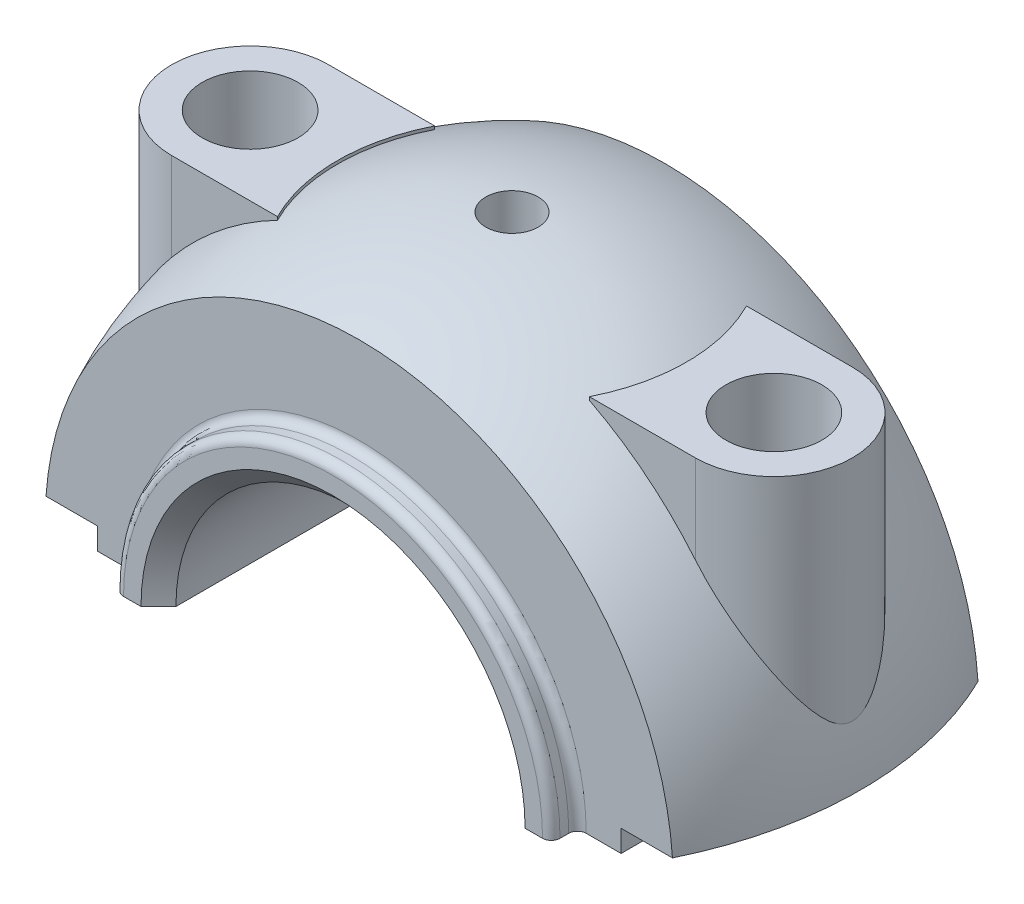
from build123d import *

# Parameters (mm, degrees)
REVOLVE1_ANGLE           = 180
BOSS_EXTRUDE1_REACH      = 58.967
BOSS_EXTRUDE1_END_RADIUS = 40
SKETCH3_R                = 5.5
CUT_EXTRUDE1_DEPTH       = 61.16851336
SKETCH4_R                = 3
CUT_EXTRUDE2_DEPTH       = 61.16851336
CUT_EXTRUDE3_DEPTH       = 61.093676973
CUT_EXTRUDE3_DEPTH_BACK  = 61.093676973
SKETCH5_W                = 18.19644254
SKETCH5_H                = 2.5
SKETCH5_W_2              = 19.029010645
CHAMFER1_SIZE            = 2
FILLET1_R                = 1


with BuildPart() as part:
    # Sketch1 → Revolve1 (revolve)
    with BuildSketch(Plane(origin=(0, 0, 0), x_dir=(1, 0, 0), z_dir=(0, 1, 0))):
        with BuildLine():
            Line((-20, 20.5), (-20, -20.5))
            Line((-20, -20.5), (-25, -20.5))
            Line((-25, -20.5), (-25, -17.5))
            Line((-25, -17.5), (-35.968736425, -17.5))
            ThreePointArc((-35.968736425, -17.5), (-40, 0), (-35.968736425, 17.5))
            Line((-35.968736425, 17.5), (-25, 17.5))
            Line((-25, 17.5), (-25, 20.5))
            Line((-25, 20.5), (-20, 20.5))
        make_face()
    revolve(axis=Axis((0, 0, 0), (0, 0, -1)), revolution_arc=REVOLVE1_ANGLE)

    # Boss-Extrude1: up to this sphere (the profile starts outside it)
    boss_extrude1_end = Location((0, 0, 0)) * Sphere(BOSS_EXTRUDE1_END_RADIUS, mode=Mode.PRIVATE)
    # Sketch2 → Boss-Extrude1 (add, up to the surface)
    with BuildSketch(Plane(origin=(0, 35, 0), x_dir=(-1, 0, 0), z_dir=(0, -1, 0)), mode=Mode.PRIVATE) as boss_extrude1_sk1:
        with BuildLine():
            Line((30, 9), (17.860571099, 9))
            ThreePointArc((17.860571099, 9), (20, 0), (17.860571099, -9))
            Line((17.860571099, -9), (30, -9))
            ThreePointArc((30, -9), (39, 0), (30, 9))
        make_face()
    boss_extrude1_tool1 = extrude(boss_extrude1_sk1.sketch, amount=BOSS_EXTRUDE1_REACH, mode=Mode.PRIVATE) - boss_extrude1_end
    boss_extrude1 = boss_extrude1_tool1.solids().sort_by_distance((-28.288022, 35, 0))[0]
    add(boss_extrude1)

    # Sketch3 → Cut-Extrude1 (cut, through all)
    with BuildSketch(Plane.XZ):
        with Locations(Location((-30, 0, 0), (0, 0, 270))):
            Circle(SKETCH3_R)
    cut_extrude1 = extrude(amount=-CUT_EXTRUDE1_DEPTH, mode=Mode.SUBTRACT)

    # Mirror1: Boss-Extrude1, Cut-Extrude1 across plane
    add(boss_extrude1.mirror(Plane(origin=(0, 0, 0), x_dir=(0, 0, 1), z_dir=(1, 0, 0))))
    add(cut_extrude1.mirror(Plane(origin=(0, 0, 0), x_dir=(0, 0, 1), z_dir=(1, 0, 0))), mode=Mode.SUBTRACT)

    # Sketch4 → Cut-Extrude2 (cut, through all)
    with BuildSketch(Plane.XZ):
        with Locations(Location((0, 0, 0), (0, 0, 270))):
            Circle(SKETCH4_R)
    extrude(amount=-CUT_EXTRUDE2_DEPTH, mode=Mode.SUBTRACT)

    # Sketch5 → Cut-Extrude3 (cut, two sides: drawn at the far end of the back side and taken through both)
    with BuildSketch(Plane.XY.offset(-CUT_EXTRUDE3_DEPTH_BACK)):
        with Locations((-39.09822127, 1.25)):
            Rectangle(SKETCH5_W, SKETCH5_H)
        with Locations((39.514505322, 1.25)):
            Rectangle(SKETCH5_W_2, SKETCH5_H)
    extrude(amount=CUT_EXTRUDE3_DEPTH + CUT_EXTRUDE3_DEPTH_BACK, mode=Mode.SUBTRACT)

    # Chamfer1
    chamfer1_edges = [part.edges().sort_by_distance(p)[0] for p in [
        (0, 20, -20.5),
        (0, 20, 20.5),
    ]]
    chamfer(chamfer1_edges, length=CHAMFER1_SIZE)

    # Fillet1
    fillet1_edges = [part.edges().sort_by_distance(p)[0] for p in [
        (0, 25, 20.5),
        (0, 25, 17.5),
        (0, 25, -17.5),
        (0, 25, -20.5),
    ]]
    fillet(fillet1_edges, radius=FILLET1_R)


solid = part.part
